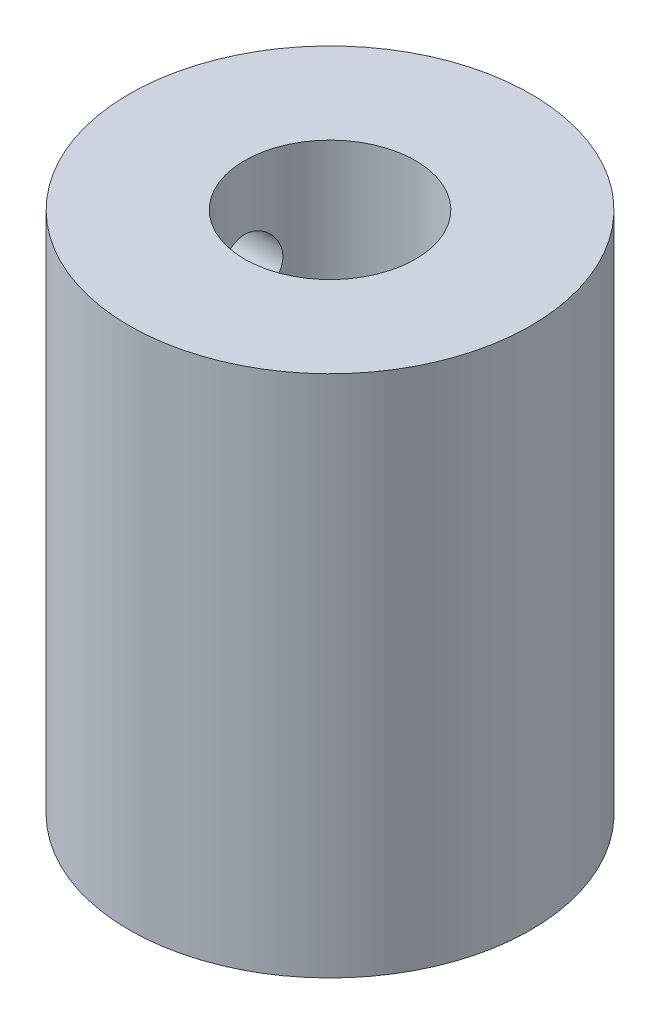
from build123d import *

# Parameters (mm, degrees)
SKETCH1_R           = 9.4
SKETCH1_R_2         = 4
BOSS_EXTRUDE1_DEPTH = 24.5
SKETCH3_R           = 1.5
CUT_EXTRUDE1_DEPTH  = 28.874181602


with BuildPart() as part:
    # Sketch1 → Boss-Extrude1 (new body)
    with BuildSketch(Plane(origin=(0, 0, 0), x_dir=(1, 0, 0), z_dir=(0, 1, 0))):
        with Locations(Location((0, 0, 0), (0, 0, 270))):
            Circle(SKETCH1_R)
        with Locations(Location((0, 0, 0), (0, 0, 270))):
            Circle(SKETCH1_R_2, mode=Mode.SUBTRACT)
    extrude(amount=BOSS_EXTRUDE1_DEPTH)

    # Sketch3 → Cut-Extrude1 (cut, through all)
    with BuildSketch(Plane(origin=(0, 0, 0), x_dir=(0, 0, -1), z_dir=(1, 0, 0))):
        with Locations((0, 4.5)):
            Circle(SKETCH3_R)
        with Locations((0, 20)):
            Circle(SKETCH3_R)
    extrude(amount=-CUT_EXTRUDE1_DEPTH, mode=Mode.SUBTRACT)


solid = part.part
